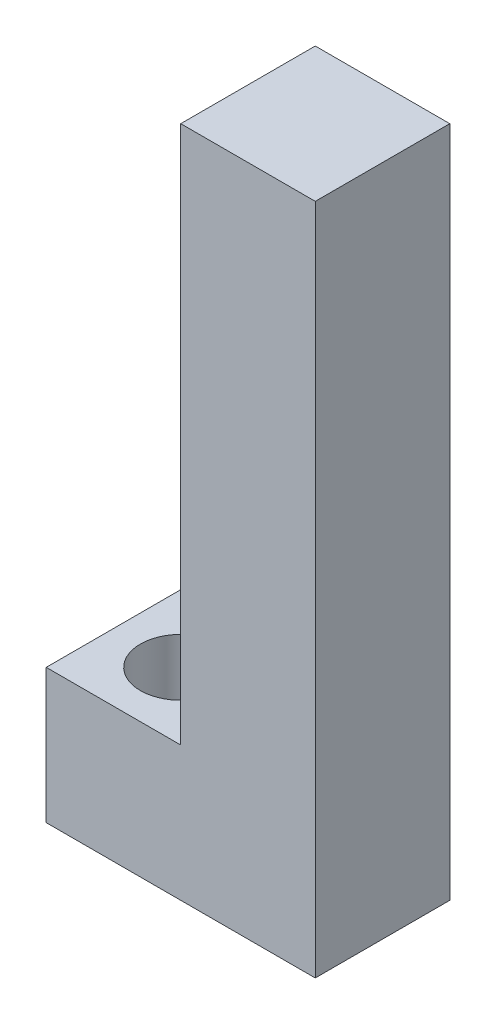
from build123d import *

# Parameters (mm, degrees)
BOSS_EXTRUDE1_DEPTH = 5
SKETCH2_R           = 1.5
CUT_EXTRUDE1_DEPTH  = 23.912878475


with BuildPart() as part:
    # Sketch1 → Boss-Extrude1 (new body)
    with BuildSketch(Plane.XY):
        Polygon((0, 0), (5, 0), (5, 20), (10, 20), (10, -5), (0, -5), align=None)
    extrude(amount=BOSS_EXTRUDE1_DEPTH)

    # Sketch2 → Cut-Extrude1 (cut, through all)
    with BuildSketch(Plane(origin=(0, 0, 0), x_dir=(1, 0, 0), z_dir=(0, 1, 0))):
        with Locations(Location((2.5, -2.5, 0), (0, 0, 270))):
            Circle(SKETCH2_R)
    extrude(amount=-CUT_EXTRUDE1_DEPTH, mode=Mode.SUBTRACT)


solid = part.part
